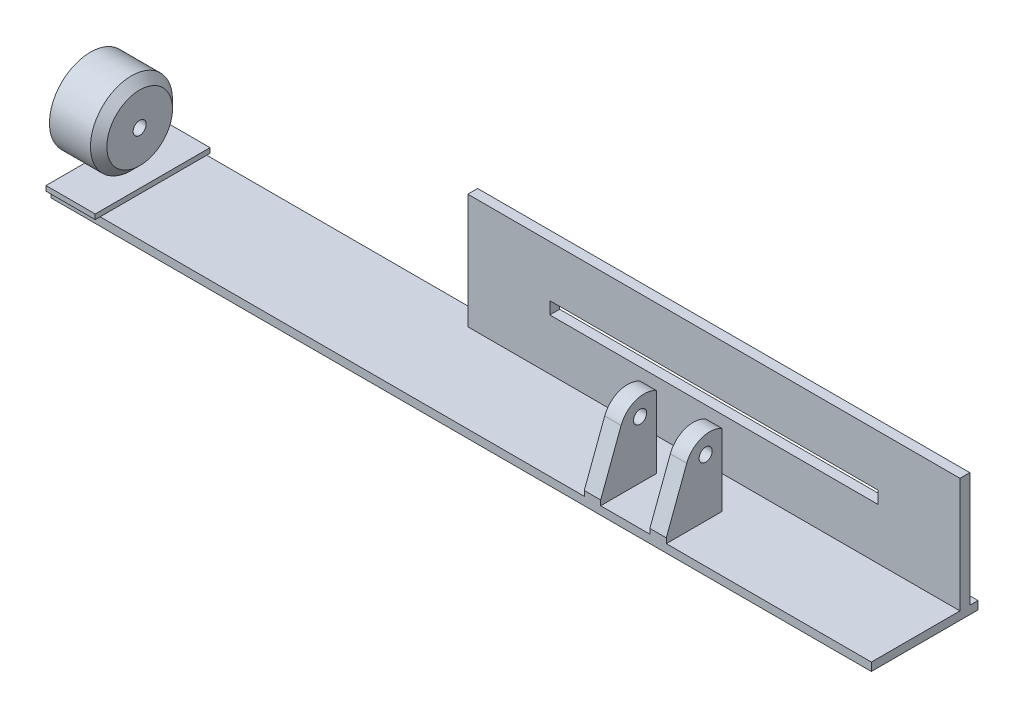
from build123d import *

# Parameters (mm, degrees)
SKETCH1_W           = 500
SKETCH1_H           = 65
BOSS_EXTRUDE1_DEPTH = 5
SKETCH2_W           = 300
SKETCH2_H           = 6
BOSS_EXTRUDE2_DEPTH = 70
CUT_EXTRUDE1_DEPTH  = 267.535175915
BOSS_EXTRUDE4_DEPTH = 10
SKETCH9_R           = 4
CUT_EXTRUDE2_DEPTH  = 384.804963491
SKETCH10_W          = 30
SKETCH10_H          = 70
BOSS_EXTRUDE5_DEPTH = 3
SKETCH11_R          = 25
BOSS_EXTRUDE6_DEPTH = 30
CHAMFER1_SIZE       = 5
SKETCH12_R          = 4
CUT_EXTRUDE3_DEPTH  = 10


with BuildPart() as part:
    # Sketch1 → Boss-Extrude1 (new body)
    with BuildSketch(Plane(origin=(0, 0, 0), x_dir=(1, 0, 0), z_dir=(0, 1, 0))):
        Rectangle(SKETCH1_W, SKETCH1_H)
    extrude(amount=BOSS_EXTRUDE1_DEPTH)

    # Sketch2 → Boss-Extrude2 (add)
    with BuildSketch(Plane(origin=(0, 5, 0), x_dir=(1, 0, 0), z_dir=(0, 1, 0))):
        with Locations((100, 24.5)):
            Rectangle(SKETCH2_W, SKETCH2_H)
    extrude(amount=BOSS_EXTRUDE2_DEPTH)

    # Sketch3 → Cut-Extrude1 (cut, through all)
    with BuildSketch(Plane.XY.offset(-21.5)):
        Polygon((0, 40), (0, 36.235), (200, 36.235), (200, 40), (200, 43.765), (0, 43.765), align=None)
    extrude(amount=-CUT_EXTRUDE1_DEPTH, mode=Mode.SUBTRACT)

    # Sketch8 → Boss-Extrude4 (add)
    with BuildSketch(Plane(origin=(115, 0, 0), x_dir=(0, 0, -1), z_dir=(1, 0, 0))):
        with BuildLine():
            Line((-32.5, 5), (-32.5, 8.060381504))
            Line((-32.5, 8.060381504), (-20.046797941, 41.169136726))
            ThreePointArc((-20.046797941, 41.169136726), (-11.050785915, 50), (1.5, 48.820953163))
            Line((1.5, 48.820953163), (1.5, 5))
            Line((1.5, 5), (-32.5, 5))
        make_face()
    boss_extrude4 = extrude(amount=BOSS_EXTRUDE4_DEPTH)

    # Mirror1: Boss-Extrude4 across plane
    add(boss_extrude4.mirror(Plane(origin=(100, 0, 0), x_dir=(0, 0, 1), z_dir=(1, 0, 0))))

    # Sketch9 → Cut-Extrude2 (cut, through all)
    with BuildSketch(Plane(origin=(125, 0, 0), x_dir=(0, 0, -1), z_dir=(1, 0, 0))):
        with Locations(Location((-8.5, 40, 0), (0, 0, 180))):
            Circle(SKETCH9_R)
    extrude(amount=-CUT_EXTRUDE2_DEPTH, mode=Mode.SUBTRACT)

    # Sketch10 → Boss-Extrude5 (add)
    with BuildSketch(Plane(origin=(0, 5, 0), x_dir=(1, 0, 0), z_dir=(0, 1, 0))):
        with Locations((-235.094269374, -0.5)):
            Rectangle(SKETCH10_W, SKETCH10_H)
    extrude(amount=BOSS_EXTRUDE5_DEPTH)


with BuildPart() as body_2:
    # Sketch11 → Boss-Extrude6 (new body)
    with BuildSketch(Plane(origin=(-250, 0, 0), x_dir=(0, 0, -1), z_dir=(1, 0, 0))):
        with Locations((-8.5, 40)):
            Circle(SKETCH11_R)
    extrude(amount=BOSS_EXTRUDE6_DEPTH)

    # Chamfer1
    chamfer1_edges = [body_2.edges().sort_by_distance(p)[0] for p in [
        (-220, 40, 33.5),
    ]]
    chamfer(chamfer1_edges, length=CHAMFER1_SIZE)

    # Sketch12 → Cut-Extrude3 (cut)
    with BuildSketch(Plane(origin=(-220, 0, 0), x_dir=(0, 0, -1), z_dir=(1, 0, 0))):
        with Locations((-8.5, 40)):
            Circle(SKETCH12_R)
    extrude(amount=-CUT_EXTRUDE3_DEPTH, mode=Mode.SUBTRACT)


solid = Compound([part.part, body_2.part])
